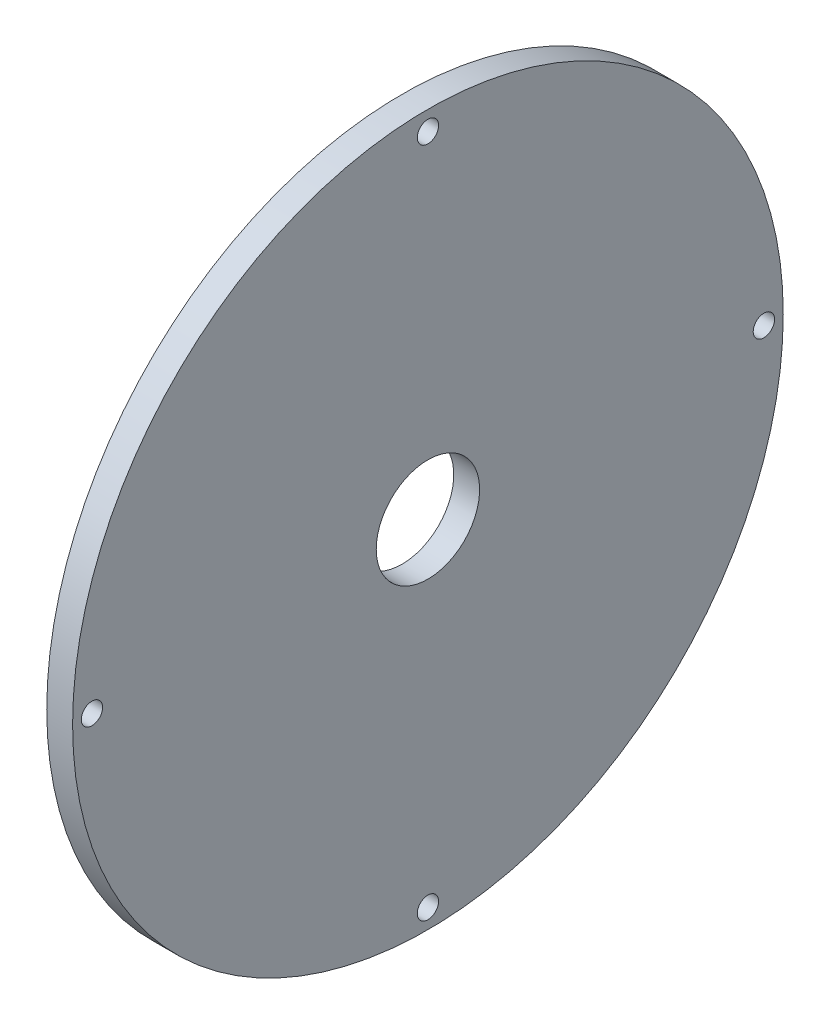
from build123d import *

# Parameters (mm, degrees)
AXIAL_PROFILE_MM_W     = 4
AXIAL_PROFILE_MM_H     = 47
AXIAL_HOLES_DEPTH      = 152.492574075
AXIAL_HOLES_DEPTH_BACK = 152.492574075
SKETCH2_R              = 1.65


with BuildPart() as part:
    # Axial profile (mm) → Full revolution (revolve)
    with BuildSketch(Plane.XY, mode=Mode.PRIVATE) as full_revolution_sk:
        with Locations((-128, 31.5)):
            Rectangle(AXIAL_PROFILE_MM_W, AXIAL_PROFILE_MM_H)
    revolve(full_revolution_sk.sketch.rotate(Axis((-110, 0, 0), (1, 0, 0)), 90), axis=Axis((-110, 0, 0), (1, 0, 0)))

    # Sketch2 → Axial holes (cut, two sides: drawn at the far end of the back side and taken through both)
    with BuildSketch(Plane(origin=(0, 0, 0), x_dir=(0, 0, -1), z_dir=(1, 0, 0)).offset(-AXIAL_HOLES_DEPTH_BACK)):
        with Locations((0, 52)):
            Circle(SKETCH2_R)
        with Locations((-52, 0)):
            Circle(SKETCH2_R)
        with Locations((0, -52)):
            Circle(SKETCH2_R)
        with Locations((52, 0)):
            Circle(SKETCH2_R)
    extrude(amount=AXIAL_HOLES_DEPTH + AXIAL_HOLES_DEPTH_BACK, mode=Mode.SUBTRACT)


solid = part.part
